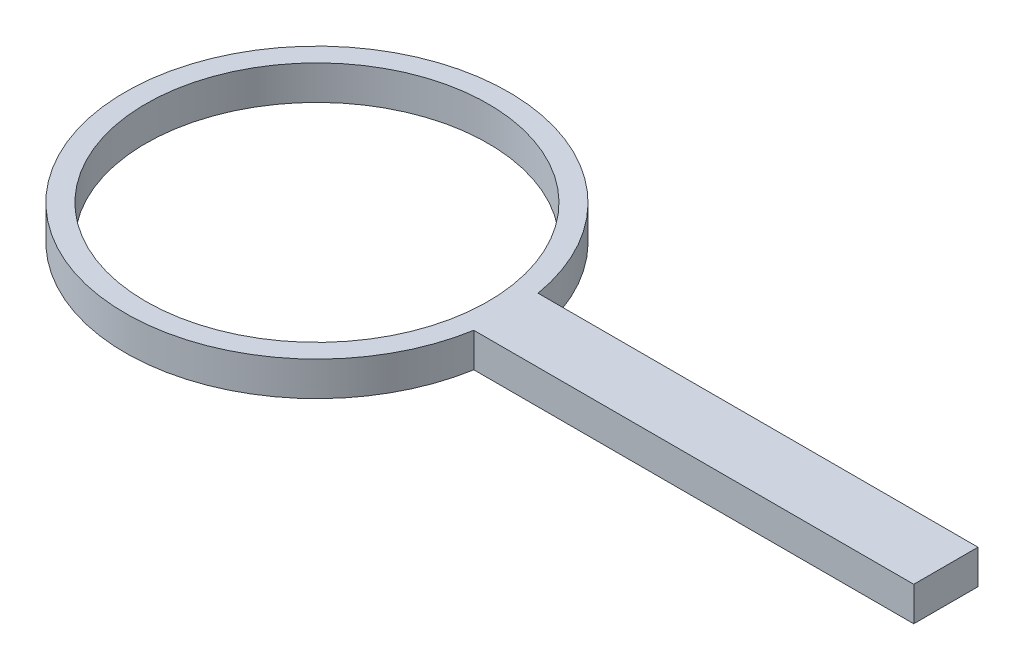
from build123d import *

# Parameters (mm, degrees)
ESQUISSE5_R             = 28
BOSS_EXTRU_5_DEPTH      = 5
ESQUISSE6_R             = 25
ENL_V_MAT_EXTRU_1_DEPTH = 10
ESQUISSE7_W             = 65
ESQUISSE7_H             = 9.382686356
BOSS_EXTRU_6_DEPTH      = 5


with BuildPart() as part:
    # Esquisse5 → Boss.-Extru.5 (new body)
    with BuildSketch(Plane(origin=(0, 5, 0), x_dir=(1, 0, 0), z_dir=(0, 1, 0))):
        with Locations(Location((-36.607266223, 0, 0), (0, 0, 270))):
            Circle(ESQUISSE5_R)
    extrude(amount=-BOSS_EXTRU_5_DEPTH)

    # Esquisse6 → Enlèv. mat.-Extru.1 (cut)
    with BuildSketch(Plane(origin=(0, 5, 0), x_dir=(1, 0, 0), z_dir=(0, 1, 0))):
        with Locations(Location((-36.607266223, 0, 0), (0, 0, 270))):
            Circle(ESQUISSE6_R)
    extrude(amount=-ENL_V_MAT_EXTRU_1_DEPTH, mode=Mode.SUBTRACT)

    # Esquisse7 → Boss.-Extru.6 (add)
    with BuildSketch(Plane(origin=(0, 5, 0), x_dir=(1, 0, 0), z_dir=(0, 1, 0))):
        with Locations((22.754788201, 0)):
            Rectangle(ESQUISSE7_W, ESQUISSE7_H)
    extrude(amount=-BOSS_EXTRU_6_DEPTH)


solid = part.part
